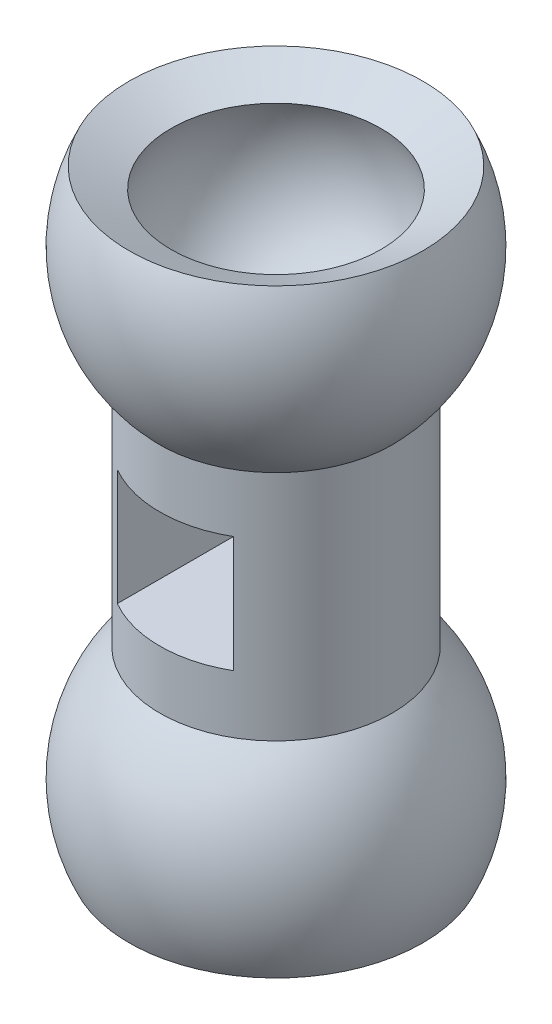
from build123d import *

# Parameters (mm, degrees)
SKETCH3_W          = 5
SKETCH3_H          = 2.5
CUT_EXTRUDE1_DEPTH = 14.999635526


with BuildPart() as part:
    # Sketch1 → Revolve1 (revolve)
    with BuildSketch(Plane.XY):
        with BuildLine():
            Line((5, -4.898979486), (5, -9.898979486))
            Line((5, -9.898979486), (0, -9.898979486))
            Line((0, -9.898979486), (0, -5))
            ThreePointArc((0, -5), (4.225771274, -2.672612419), (4.517539515, 2.142857143))
            Line((4.517539515, 2.142857143), (6.32455532, 3))
            ThreePointArc((6.32455532, 3), (6.903611919, -1.157645227), (5, -4.898979486))
        make_face()
    revolve1 = revolve(axis=Axis((0, 12.862963673, 0), (0, -1, 0)))

    # Sketch3 → Cut-Extrude1 (cut, symmetric)
    with BuildSketch(Plane.XY):
        with Locations((0, -8.648979486)):
            Rectangle(SKETCH3_W, SKETCH3_H)
    cut_extrude1 = extrude(amount=CUT_EXTRUDE1_DEPTH, both=True, mode=Mode.SUBTRACT)

    # Mirror1: Revolve1, Cut-Extrude1 across plane
    add(revolve1.mirror(Plane(origin=(5, -9.898979486, 0), x_dir=(0, 0, 1), z_dir=(0, 1, 0))))
    add(cut_extrude1.mirror(Plane(origin=(5, -9.898979486, 0), x_dir=(0, 0, 1), z_dir=(0, 1, 0))), mode=Mode.SUBTRACT)


solid = part.part
